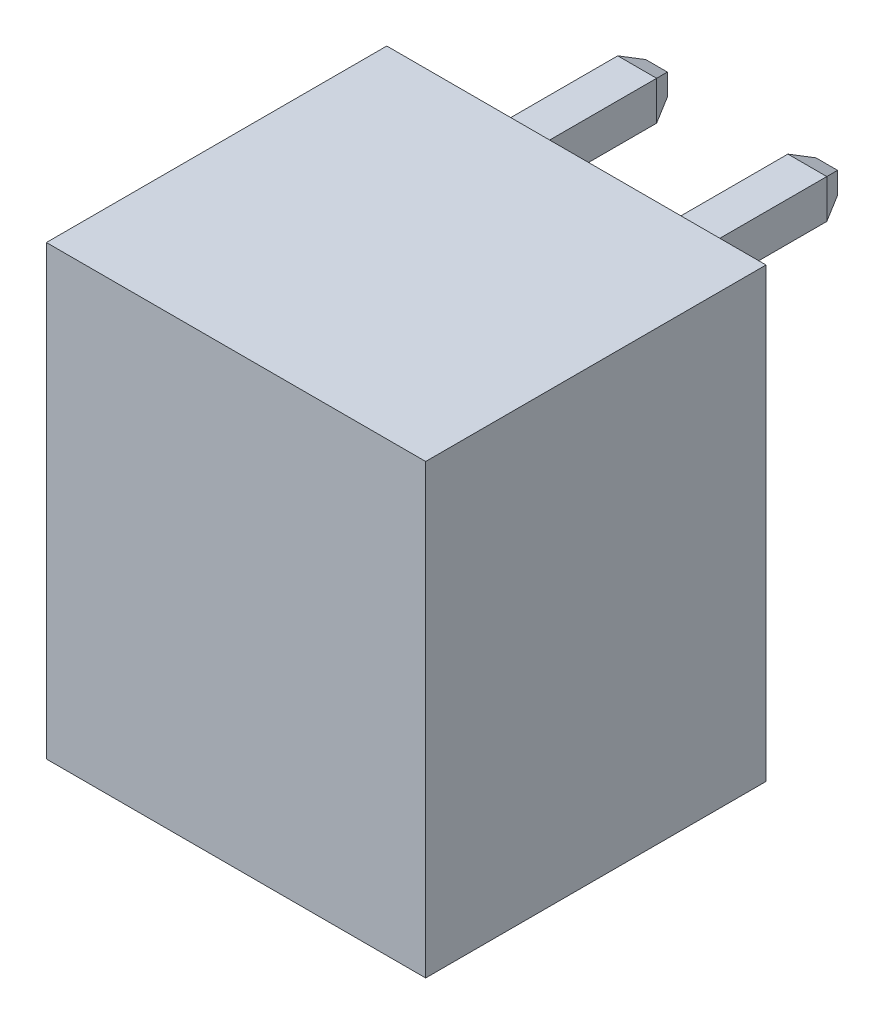
from build123d import *
from OCP.BRepFilletAPI import BRepFilletAPI_MakeChamfer

# Parameters (mm, degrees)
SKETCH_1_W                          = 7.8
SKETCH_1_H                          = 9.2
EXTRUDE_1_DEPTH                     = 7
SKETCH_2_W                          = 0.8
SKETCH_2_H                          = 0.8
EXTRUDE_2_DEPTH                     = 3.4
CHAMFER_1_SIZE                      = 0.4
CHAMFER_1_SIZE2                     = 0.178091474
CUT_EXTRUDE_1_DEPTH                 = 7
PATTERN_LINEAR_1_COUNT              = 3
PATTERN_LINEAR_1_PITCH              = 3.5
CHAMFER_1_OF_PATTERN_LINEAR_1_SIZE  = 0.4
CHAMFER_1_OF_PATTERN_LINEAR_1_SIZE2 = 0.178091474
PATTERN_LINEAR_2_COUNT              = 2
PATTERN_LINEAR_2_PITCH              = 3.5
SKETCH_4_W                          = 0.8
SKETCH_4_H                          = 0.8
EXTRUDE_3_DEPTH                     = 6
CHAMFER_2_SIZE                      = 0.4
CHAMFER_2_SIZE2                     = 0.178091474
PATTERN_LINEAR_3_COUNT              = 2
PATTERN_LINEAR_3_PITCH              = 3.5
CHAMFER_2_OF_PATTERN_LINEAR_3_SIZE  = 0.4
CHAMFER_2_OF_PATTERN_LINEAR_3_SIZE2 = 0.178091474


with BuildPart() as part:
    # Эскиз1 → Бобышка-Вытянуть1 (new body)
    with BuildSketch(Plane.XY):
        with Locations((0, 4.6)):
            Rectangle(SKETCH_1_W, SKETCH_1_H)
    extrude(amount=EXTRUDE_1_DEPTH)

    # Эскиз2 → Бобышка-Вытянуть2 (add)
    with BuildSketch(Plane(origin=(0, 0, 0), x_dir=(-1, 0, 0), z_dir=(0, 0, -1))):
        with Locations((-1.75, 8)):
            Rectangle(SKETCH_2_W, SKETCH_2_H)
    extrude_2 = extrude(amount=EXTRUDE_2_DEPTH)

    # Фаска1: one chamfer whose edges measure the first distance from different faces: ONE call of the kernel's chamfer builder (chamfer() names one face for all edges)
    chamfer_1_edges_1 = [part.edges().sort_by_distance(p)[0] for p in [
        (1.35, 8, -3.4),
    ]]
    chamfer_1_side_1 = [part.faces().sort_by_distance(p)[0] for p in [
        (1.35, 8, -1.7),
    ]]
    chamfer_1_edges_2 = [part.edges().sort_by_distance(p)[0] for p in [
        (1.75, 8.4, -3.4),
    ]]
    chamfer_1_side_2 = [part.faces().sort_by_distance(p)[0] for p in [
        (1.75, 8.4, -1.7),
    ]]
    chamfer_1_edges_3 = [part.edges().sort_by_distance(p)[0] for p in [
        (2.15, 8, -3.4),
    ]]
    chamfer_1_side_3 = [part.faces().sort_by_distance(p)[0] for p in [
        (2.15, 8, -1.7),
    ]]
    chamfer_1_edges_4 = [part.edges().sort_by_distance(p)[0] for p in [
        (1.75, 7.6, -3.4),
    ]]
    chamfer_1_side_4 = [part.faces().sort_by_distance(p)[0] for p in [
        (1.75, 7.6, -1.7),
    ]]
    chamfer_1 = BRepFilletAPI_MakeChamfer(part.part.solid().wrapped)
    for e in chamfer_1_edges_1:
        chamfer_1.Add(CHAMFER_1_SIZE, CHAMFER_1_SIZE2, e.wrapped, chamfer_1_side_1[0].wrapped)  # the first distance lies on this face
    for e in chamfer_1_edges_2:
        chamfer_1.Add(CHAMFER_1_SIZE, CHAMFER_1_SIZE2, e.wrapped, chamfer_1_side_2[0].wrapped)  # the first distance lies on this face
    for e in chamfer_1_edges_3:
        chamfer_1.Add(CHAMFER_1_SIZE, CHAMFER_1_SIZE2, e.wrapped, chamfer_1_side_3[0].wrapped)  # the first distance lies on this face
    for e in chamfer_1_edges_4:
        chamfer_1.Add(CHAMFER_1_SIZE, CHAMFER_1_SIZE2, e.wrapped, chamfer_1_side_4[0].wrapped)  # the first distance lies on this face
    add(Compound.cast(chamfer_1.Shape()), mode=Mode.REPLACE)

    # Эскиз3 → Вырез-Вытянуть1 (cut)
    with BuildSketch(Plane.XZ):
        Polygon((0.15, 0.8), (3.25, 0.8), (3.25, 5), (2.25, 5), (3.25, 6.5), (0.15, 6.5), (1.15, 5), (0.15, 5), align=None)
    cut_extrude_1 = extrude(amount=-CUT_EXTRUDE_1_DEPTH, mode=Mode.SUBTRACT)

    # Линейный массив1: Бобышка-Вытянуть2 ×3, 1 skipped
    with Locations(*[(-i * PATTERN_LINEAR_1_PITCH, 0, 0) for i in range(1, PATTERN_LINEAR_1_COUNT) if i not in (2,)]):
        add(extrude_2)

    # Фаска1 of Линейный массив1: one chamfer whose edges measure the first distance from different faces: ONE call of the kernel's chamfer builder (chamfer() names one face for all edges)
    chamfer_1_of_pattern_linear_1_edges_1 = [part.edges().sort_by_distance(p)[0] for p in [
        (-2.15, 8, -3.4),
    ]]
    chamfer_1_of_pattern_linear_1_side_1 = [part.faces().sort_by_distance(p)[0] for p in [
        (-2.15, 8, -1.7),
    ]]
    chamfer_1_of_pattern_linear_1_edges_2 = [part.edges().sort_by_distance(p)[0] for p in [
        (-1.75, 8.4, -3.4),
    ]]
    chamfer_1_of_pattern_linear_1_side_2 = [part.faces().sort_by_distance(p)[0] for p in [
        (-1.75, 8.4, -1.7),
    ]]
    chamfer_1_of_pattern_linear_1_edges_3 = [part.edges().sort_by_distance(p)[0] for p in [
        (-1.35, 8, -3.4),
    ]]
    chamfer_1_of_pattern_linear_1_side_3 = [part.faces().sort_by_distance(p)[0] for p in [
        (-1.35, 8, -1.7),
    ]]
    chamfer_1_of_pattern_linear_1_edges_4 = [part.edges().sort_by_distance(p)[0] for p in [
        (-1.75, 7.6, -3.4),
    ]]
    chamfer_1_of_pattern_linear_1_side_4 = [part.faces().sort_by_distance(p)[0] for p in [
        (-1.75, 7.6, -1.7),
    ]]
    chamfer_1_of_pattern_linear_1 = BRepFilletAPI_MakeChamfer(part.part.solid().wrapped)
    for e in chamfer_1_of_pattern_linear_1_edges_1:
        chamfer_1_of_pattern_linear_1.Add(CHAMFER_1_OF_PATTERN_LINEAR_1_SIZE, CHAMFER_1_OF_PATTERN_LINEAR_1_SIZE2, e.wrapped, chamfer_1_of_pattern_linear_1_side_1[0].wrapped)  # the first distance lies on this face
    for e in chamfer_1_of_pattern_linear_1_edges_2:
        chamfer_1_of_pattern_linear_1.Add(CHAMFER_1_OF_PATTERN_LINEAR_1_SIZE, CHAMFER_1_OF_PATTERN_LINEAR_1_SIZE2, e.wrapped, chamfer_1_of_pattern_linear_1_side_2[0].wrapped)  # the first distance lies on this face
    for e in chamfer_1_of_pattern_linear_1_edges_3:
        chamfer_1_of_pattern_linear_1.Add(CHAMFER_1_OF_PATTERN_LINEAR_1_SIZE, CHAMFER_1_OF_PATTERN_LINEAR_1_SIZE2, e.wrapped, chamfer_1_of_pattern_linear_1_side_3[0].wrapped)  # the first distance lies on this face
    for e in chamfer_1_of_pattern_linear_1_edges_4:
        chamfer_1_of_pattern_linear_1.Add(CHAMFER_1_OF_PATTERN_LINEAR_1_SIZE, CHAMFER_1_OF_PATTERN_LINEAR_1_SIZE2, e.wrapped, chamfer_1_of_pattern_linear_1_side_4[0].wrapped)  # the first distance lies on this face
    add(Compound.cast(chamfer_1_of_pattern_linear_1.Shape()), mode=Mode.REPLACE)

    # Линейный массив2: Вырез-Вытянуть1 ×2
    with Locations(*[(-i * PATTERN_LINEAR_2_PITCH, 0, 0) for i in range(1, PATTERN_LINEAR_2_COUNT)]):
        add(cut_extrude_1, mode=Mode.SUBTRACT)

    # Эскиз4 → Бобышка-Вытянуть3 (add)
    with BuildSketch(Plane.XZ.offset(-7)):
        with Locations((1.75, 3)):
            Rectangle(SKETCH_4_W, SKETCH_4_H)
    extrude_3 = extrude(amount=EXTRUDE_3_DEPTH)

    # Фаска2: one chamfer whose edges measure the first distance from different faces: ONE call of the kernel's chamfer builder (chamfer() names one face for all edges)
    chamfer_2_edges_1 = [part.edges().sort_by_distance(p)[0] for p in [
        (2.15, 1, 3),
    ]]
    chamfer_2_side_1 = [part.faces().sort_by_distance(p)[0] for p in [
        (2.15, 4, 3),
    ]]
    chamfer_2_edges_2 = [part.edges().sort_by_distance(p)[0] for p in [
        (1.75, 1, 3.4),
    ]]
    chamfer_2_side_2 = [part.faces().sort_by_distance(p)[0] for p in [
        (1.75, 4, 3.4),
    ]]
    chamfer_2_edges_3 = [part.edges().sort_by_distance(p)[0] for p in [
        (1.35, 1, 3),
    ]]
    chamfer_2_side_3 = [part.faces().sort_by_distance(p)[0] for p in [
        (1.35, 4, 3),
    ]]
    chamfer_2_edges_4 = [part.edges().sort_by_distance(p)[0] for p in [
        (1.75, 1, 2.6),
    ]]
    chamfer_2_side_4 = [part.faces().sort_by_distance(p)[0] for p in [
        (1.75, 4, 2.6),
    ]]
    chamfer_2 = BRepFilletAPI_MakeChamfer(part.part.solid().wrapped)
    for e in chamfer_2_edges_1:
        chamfer_2.Add(CHAMFER_2_SIZE, CHAMFER_2_SIZE2, e.wrapped, chamfer_2_side_1[0].wrapped)  # the first distance lies on this face
    for e in chamfer_2_edges_2:
        chamfer_2.Add(CHAMFER_2_SIZE, CHAMFER_2_SIZE2, e.wrapped, chamfer_2_side_2[0].wrapped)  # the first distance lies on this face
    for e in chamfer_2_edges_3:
        chamfer_2.Add(CHAMFER_2_SIZE, CHAMFER_2_SIZE2, e.wrapped, chamfer_2_side_3[0].wrapped)  # the first distance lies on this face
    for e in chamfer_2_edges_4:
        chamfer_2.Add(CHAMFER_2_SIZE, CHAMFER_2_SIZE2, e.wrapped, chamfer_2_side_4[0].wrapped)  # the first distance lies on this face
    add(Compound.cast(chamfer_2.Shape()), mode=Mode.REPLACE)

    # Линейный массив3: Бобышка-Вытянуть3 ×2
    with Locations(*[(-i * PATTERN_LINEAR_3_PITCH, 0, 0) for i in range(1, PATTERN_LINEAR_3_COUNT)]):
        add(extrude_3)

    # Фаска2 of Линейный массив3: one chamfer whose edges measure the first distance from different faces: ONE call of the kernel's chamfer builder (chamfer() names one face for all edges)
    chamfer_2_of_pattern_linear_3_edges_1 = [part.edges().sort_by_distance(p)[0] for p in [
        (-1.35, 1, 3),
    ]]
    chamfer_2_of_pattern_linear_3_side_1 = [part.faces().sort_by_distance(p)[0] for p in [
        (-1.35, 4, 3),
    ]]
    chamfer_2_of_pattern_linear_3_edges_2 = [part.edges().sort_by_distance(p)[0] for p in [
        (-1.75, 1, 3.4),
    ]]
    chamfer_2_of_pattern_linear_3_side_2 = [part.faces().sort_by_distance(p)[0] for p in [
        (-1.75, 4, 3.4),
    ]]
    chamfer_2_of_pattern_linear_3_edges_3 = [part.edges().sort_by_distance(p)[0] for p in [
        (-2.15, 1, 3),
    ]]
    chamfer_2_of_pattern_linear_3_side_3 = [part.faces().sort_by_distance(p)[0] for p in [
        (-2.15, 4, 3),
    ]]
    chamfer_2_of_pattern_linear_3_edges_4 = [part.edges().sort_by_distance(p)[0] for p in [
        (-1.75, 1, 2.6),
    ]]
    chamfer_2_of_pattern_linear_3_side_4 = [part.faces().sort_by_distance(p)[0] for p in [
        (-1.75, 4, 2.6),
    ]]
    chamfer_2_of_pattern_linear_3 = BRepFilletAPI_MakeChamfer(part.part.solid().wrapped)
    for e in chamfer_2_of_pattern_linear_3_edges_1:
        chamfer_2_of_pattern_linear_3.Add(CHAMFER_2_OF_PATTERN_LINEAR_3_SIZE, CHAMFER_2_OF_PATTERN_LINEAR_3_SIZE2, e.wrapped, chamfer_2_of_pattern_linear_3_side_1[0].wrapped)  # the first distance lies on this face
    for e in chamfer_2_of_pattern_linear_3_edges_2:
        chamfer_2_of_pattern_linear_3.Add(CHAMFER_2_OF_PATTERN_LINEAR_3_SIZE, CHAMFER_2_OF_PATTERN_LINEAR_3_SIZE2, e.wrapped, chamfer_2_of_pattern_linear_3_side_2[0].wrapped)  # the first distance lies on this face
    for e in chamfer_2_of_pattern_linear_3_edges_3:
        chamfer_2_of_pattern_linear_3.Add(CHAMFER_2_OF_PATTERN_LINEAR_3_SIZE, CHAMFER_2_OF_PATTERN_LINEAR_3_SIZE2, e.wrapped, chamfer_2_of_pattern_linear_3_side_3[0].wrapped)  # the first distance lies on this face
    for e in chamfer_2_of_pattern_linear_3_edges_4:
        chamfer_2_of_pattern_linear_3.Add(CHAMFER_2_OF_PATTERN_LINEAR_3_SIZE, CHAMFER_2_OF_PATTERN_LINEAR_3_SIZE2, e.wrapped, chamfer_2_of_pattern_linear_3_side_4[0].wrapped)  # the first distance lies on this face
    add(Compound.cast(chamfer_2_of_pattern_linear_3.Shape()), mode=Mode.REPLACE)


solid = part.part
